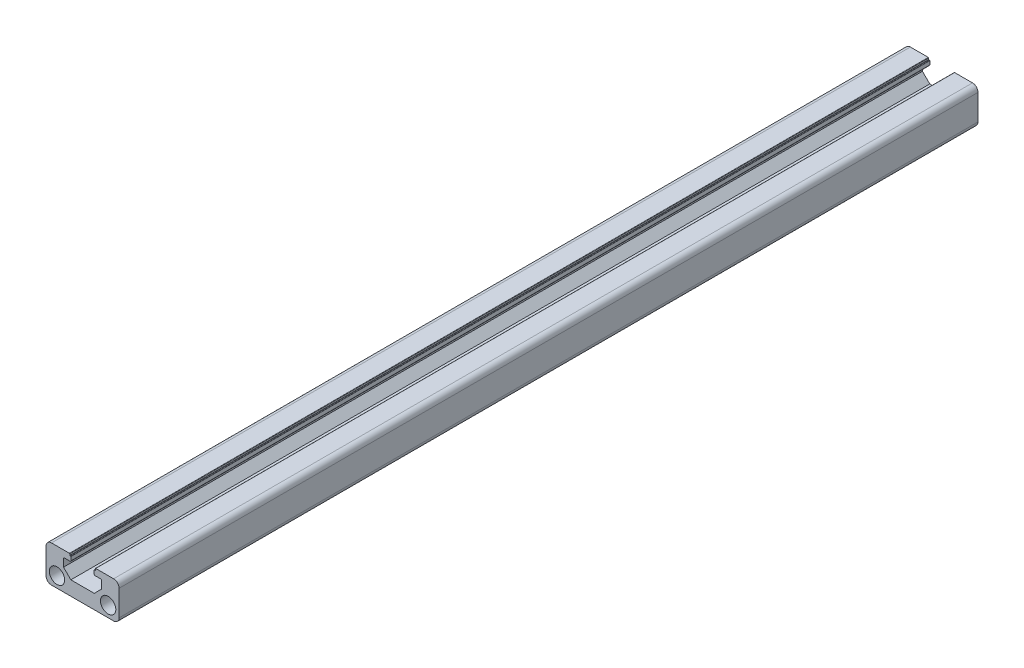
from build123d import *

# Parameters (mm, degrees)
SKETCH_1_R      = 2.1
EXTRUDE_1_DEPTH = 235
FILLET_1_R      = 0.1
FILLET_2_R      = 0.2


with BuildPart() as part:
    # 草图1 → 凸台-拉伸1 (new body)
    with BuildSketch(Plane.XY):
        with BuildLine():
            Line((8.5, -3.9), (-8.5, -3.9))
            ThreePointArc((-8.5, -3.9), (-9.560660172, -3.460660172), (-10, -2.4))
            Line((-10, -2.4), (-10, 4.6))
            ThreePointArc((-10, 4.6), (-9.560660172, 5.660660172), (-8.5, 6.1))
            Line((-8.5, 6.1), (-3.5, 6.1))
            Line((-3.5, 6.1), (-3.5, 5.6))
            Line((-3.5, 5.6), (-3.2, 5.6))
            Line((-3.2, 5.6), (-3.2, 4.3))
            Line((-3.2, 4.3), (-5.2, 4.3))
            Line((-5.2, 4.3), (-5.2, 2))
            Line((-5.2, 2), (-3.2, 0))
            Line((-3.2, 0), (3.2, 0))
            Line((3.2, 0), (5.2, 2))
            Line((5.2, 2), (5.2, 4.3))
            Line((5.2, 4.3), (3.2, 4.3))
            Line((3.2, 4.3), (3.2, 5.6))
            Line((3.2, 5.6), (3.5, 5.6))
            Line((3.5, 5.6), (3.5, 6.1))
            Line((3.5, 6.1), (8.5, 6.1))
            ThreePointArc((8.5, 6.1), (9.560660172, 5.660660172), (10, 4.6))
            Line((10, 4.6), (10, -2.4))
            ThreePointArc((10, -2.4), (9.560660172, -3.460660172), (8.5, -3.9))
        make_face()
        with Locations(Location((-7, -0.9, 0), (0, 0, 180))):
            Circle(SKETCH_1_R, mode=Mode.SUBTRACT)
        with Locations(Location((7, -0.9, 0), (0, 0, 180))):
            Circle(SKETCH_1_R, mode=Mode.SUBTRACT)
    extrude(amount=EXTRUDE_1_DEPTH)

    # 圆角1
    fillet_1_edges = [part.edges().sort_by_distance(p)[0] for p in [
        (3.2, 5.6, 117.5),
        (3.5, 6.1, 117.5),
        (-3.5, 6.1, 117.5),
        (-3.2, 5.6, 117.5),
    ]]
    fillet(fillet_1_edges, radius=FILLET_1_R)

    # 圆角2
    fillet_2_edges = [part.edges().sort_by_distance(p)[0] for p in [
        (5.2, 4.3, 117.5),
        (3.2, 4.3, 117.5),
        (-3.2, 4.3, 117.5),
        (-5.2, 4.3, 117.5),
    ]]
    fillet(fillet_2_edges, radius=FILLET_2_R)


solid = part.part
